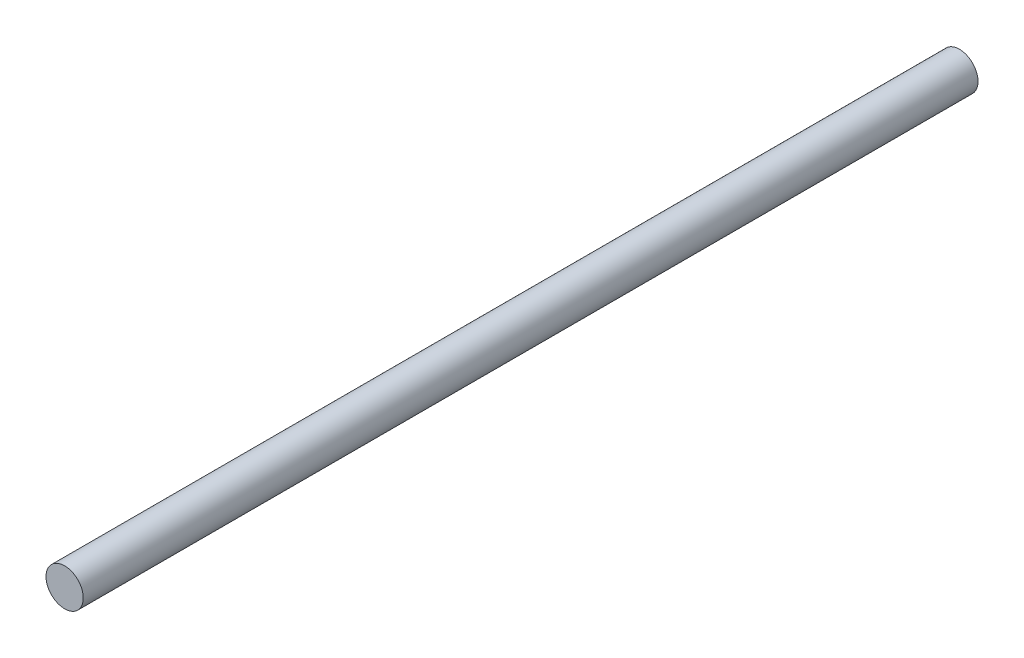
from build123d import *

# Parameters (mm, degrees)
SKETCH1_R           = 6.35
BOSS_EXTRUDE1_DEPTH = 152.4


with BuildPart() as part:
    # Sketch1 → Boss-Extrude1 (new, symmetric)
    with BuildSketch(Plane.XY):
        with Locations(Location((0, 0, 0), (0, 0, 180))):
            Circle(SKETCH1_R)
    extrude(amount=BOSS_EXTRUDE1_DEPTH, both=True)


solid = part.part
